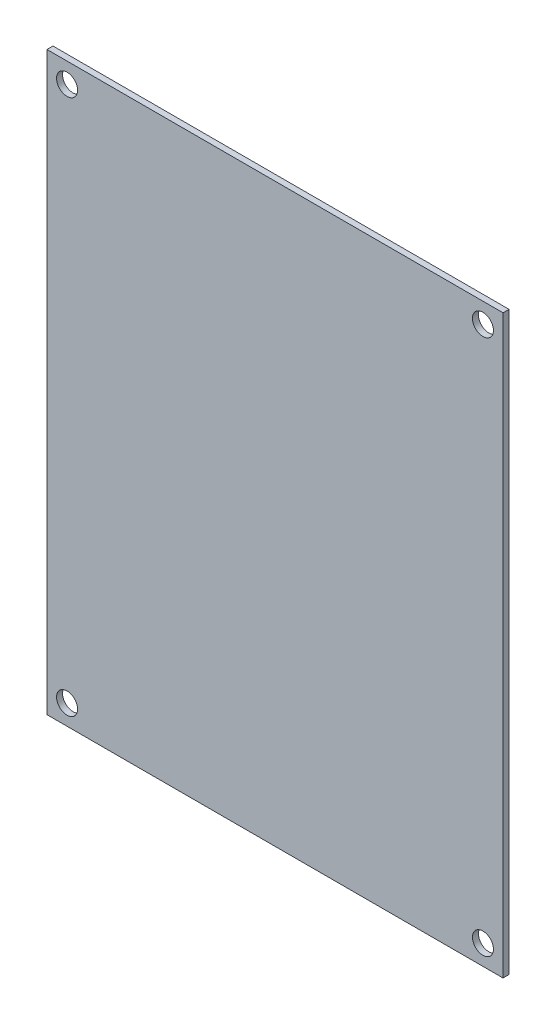
from build123d import *

# Parameters (mm, degrees)
SKETCH1_W           = 76
SKETCH1_H           = 96
SKETCH1_R           = 1.75
BOSS_EXTRUDE1_DEPTH = 1


with BuildPart() as part:
    # Sketch1 → Boss-Extrude1 (new body)
    with BuildSketch(Plane.XY):
        Rectangle(SKETCH1_W, SKETCH1_H)
        with Locations((-34.65, 44.65)):
            Circle(SKETCH1_R, mode=Mode.SUBTRACT)
        with Locations((34.65, 44.65)):
            Circle(SKETCH1_R, mode=Mode.SUBTRACT)
        with Locations((34.65, -44.65)):
            Circle(SKETCH1_R, mode=Mode.SUBTRACT)
        with Locations((-34.65, -44.65)):
            Circle(SKETCH1_R, mode=Mode.SUBTRACT)
    extrude(amount=BOSS_EXTRUDE1_DEPTH)


solid = part.part
